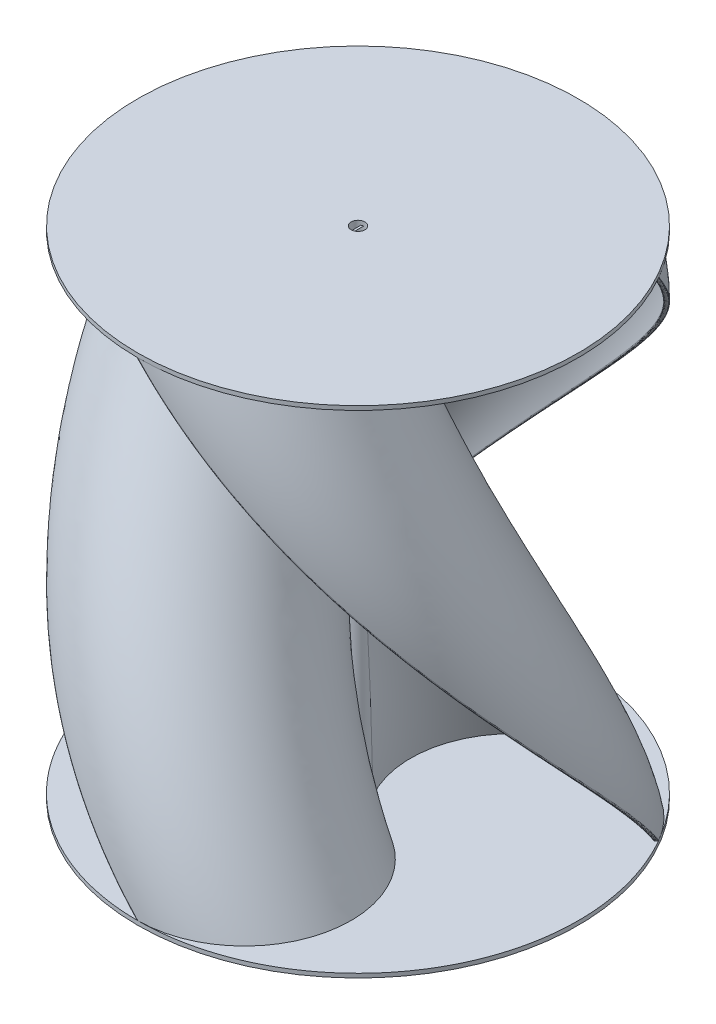
from build123d import *
from build123d.topology import SkipClean

# Parameters (mm, degrees)
SKETCH2_R           = 8
SKETCH2_R_2         = 5
BOSS_EXTRUDE1_DEPTH = 354
SWEEP1_PITCH        = 1062
SWEEP1_HEIGHT       = 354
SWEEP1_RADIUS       = 160
CIRPATTERN1_COUNT   = 3
SKETCH4_R           = 160.000000003
SKETCH4_R_2         = 5
BOSS_EXTRUDE2_DEPTH = 3
BOSS_EXTRUDE3_START = 3
SKETCH5_R           = 160
SKETCH5_R_2         = 5
BOSS_EXTRUDE3_DEPTH = 3


with BuildPart() as part:
    # Sketch2 → Boss-Extrude1 (new body)
    with BuildSketch(Plane(origin=(0, 0, 0), x_dir=(1, 0, 0), z_dir=(0, 1, 0))):
        with Locations(Location((0, 0, 0), (0, 0, 270))):
            Circle(SKETCH2_R)
        with Locations(Location((0, 0, 0), (0, 0, 270))):
            Circle(SKETCH2_R_2, mode=Mode.SUBTRACT)
    extrude(amount=BOSS_EXTRUDE1_DEPTH)

    # Sweep1: sweep along a helix
    with BuildLine() as sweep1_path:
        Helix(SWEEP1_PITCH, SWEEP1_HEIGHT, SWEEP1_RADIUS, center=(0, 0, 0), direction=(0, 1, 0), lefthand=True)
    with BuildLine() as sweep1_axis:
        Line((0, 0, 0), (0, 354, 0))
    # Sketch3 → Sweep1 (sweep)
    with BuildSketch(Plane(origin=(0, 0, 0), x_dir=(1, 0, 0), z_dir=(0, 1, 0))):
        with BuildLine():
            ThreePointArc((0, -160), (77.5, -82.5), (0, -5))
            ThreePointArc((0, -5), (-1.5, -6.5), (0, -8))
            ThreePointArc((0, -8), (74.5, -82.5), (0, -157))
            ThreePointArc((0, -157), (-1.5, -158.5), (0, -160))
        make_face()
    sweep1 = sweep(path=sweep1_path.line, binormal=sweep1_axis.edges()[0])

    # CirPattern1: Sweep1 ×3 about axis
    cirpattern1_axis = Axis((0, 371.7, 0), (0, -1, 0))
    for i in range(1, CIRPATTERN1_COUNT):
        add(sweep1.rotate(cirpattern1_axis, i * 360 / CIRPATTERN1_COUNT))

    # Sketch4 → Boss-Extrude2 (add)
    with BuildSketch(Plane(origin=(0, 354, 0), x_dir=(1, 0, 0), z_dir=(0, 1, 0))):
        with Locations(Location((0, 0, 0), (0, 0, 30.00016535))):
            Circle(SKETCH4_R)
        with Locations(Location((0, 0, 0), (0, 0, 270))):
            Circle(SKETCH4_R_2, mode=Mode.SUBTRACT)
    extrude(amount=BOSS_EXTRUDE2_DEPTH)

    # Sketch5 → Boss-Extrude3 (add)
    with SkipClean():  # the faces are left unmerged after this step: merging them gives an invalid solid
        with BuildSketch(Plane.XZ.offset(BOSS_EXTRUDE3_START)):
            with Locations(Location((0, 0, 0), (0, 0, 329.99983465))):
                Circle(SKETCH5_R)
            with Locations(Location((0, 0, 0), (0, 0, 270))):
                Circle(SKETCH5_R_2, mode=Mode.SUBTRACT)
        extrude(amount=-BOSS_EXTRUDE3_DEPTH)


solid = part.part
